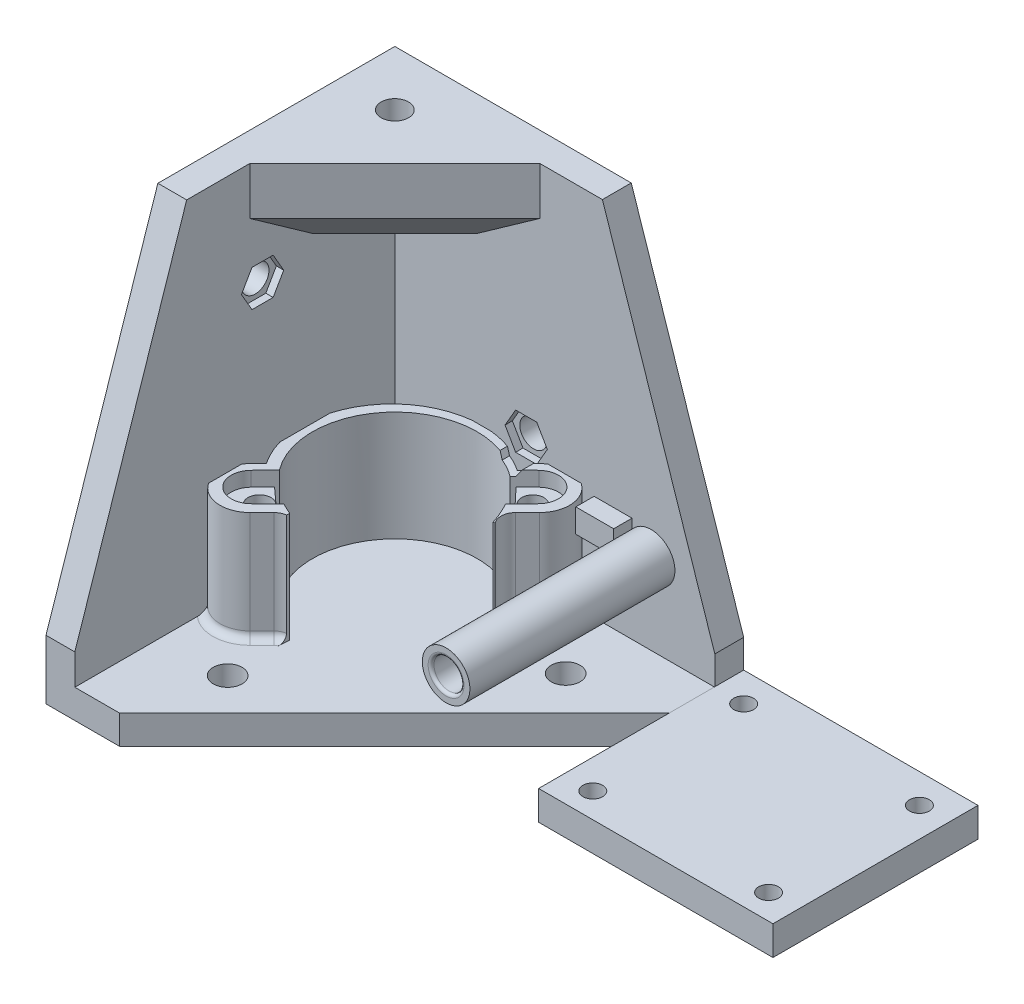
from build123d import *

# Parameters (mm, degrees)
BOSS_EXTRUDE1_DEPTH     = 5
BOSS_EXTRUDE2_DEPTH     = 5
BOSS_EXTRUDE3_DEPTH     = 5
SKETCH6_R               = 2.5
CUT_EXTRUDE1_DEPTH      = 107.549284371
SKETCH9_R               = 4.1275
SKETCH9_R_2             = 2.6035
BOSS_EXTRUDE5_DEPTH     = 35.56
FILLET1_R               = 0.508
BOSS_EXTRUDE6_DEPTH     = 19.05
SKETCH15_R              = 2.38125
BOSS_EXTRUDE7_DEPTH     = 15.875
CHAMFER2_SIZE           = 7.62
FILLET2_R               = 1.27
SKETCH16_W              = 7.844007501
SKETCH16_H              = 4.112882263
BOSS_EXTRUDE8_DEPTH     = 3.175
CHAMFER3_SIZE           = 1.27
SKETCH17_R              = 1.984375
SKETCH17_R_2            = 1.9288125
BOSS_EXTRUDE9_DEPTH     = 16.51
CUT_EXTRUDE2_REACH      = 111.603
SKETCH18_R              = 2.38125
CUT_EXTRUDE3_REACH      = 111.603
SKETCH19_R              = 2.38125
CUT_EXTRUDE4_DEPTH      = 4.13271
CUT_EXTRUDE4_DEPTH_BACK = 1.27
CUT_EXTRUDE5_DEPTH      = 1.27
SKETCH23_W              = 40.64
SKETCH23_H              = 35.56
BOSS_EXTRUDE12_DEPTH    = 5.08
CUT_EXTRUDE6_REACH      = 135.834
SKETCH24_R              = 1.7145


with BuildPart() as part:
    # Sketch1 → Boss-Extrude1 (new body)
    with BuildSketch(Plane(origin=(0, 0, 0), x_dir=(1, 0, 0), z_dir=(0, 1, 0))):
        Polygon((0, 0), (0, 60.5), (60.5, 60.5), (60.5, 47.75), (12.75, 0), align=None)
    extrude(amount=BOSS_EXTRUDE1_DEPTH)

    # Sketch4 → Boss-Extrude2 (add)
    with BuildSketch(Plane.ZY):
        Polygon((-60.5, 5), (-60.5, 68.5), (-19.4, 68.5), (0, 10.308629506), (0, 5), align=None)
    extrude(amount=-BOSS_EXTRUDE2_DEPTH)

    # Sketch5 → Boss-Extrude3 (add)
    with BuildSketch(Plane(origin=(0, 0, -60.5), x_dir=(-1, 0, 0), z_dir=(0, 0, -1))):
        Polygon((-5, 5), (-5, 68.5), (-41, 68.5), (-60.5, 10.004653177), (-60.5, 5), align=None)
    extrude(amount=-BOSS_EXTRUDE3_DEPTH)

    # Sketch6 → Cut-Extrude1 (cut, through all)
    with BuildSketch(Plane(origin=(0, 5, 0), x_dir=(1, 0, 0), z_dir=(0, 1, 0))):
        with Locations(Location((16.5, 15, 0), (0, 0, 270))):
            Circle(SKETCH6_R)
        with Locations(Location((45.5, 44.625, 0), (0, 0, 270))):
            Circle(SKETCH6_R)
    extrude(amount=-CUT_EXTRUDE1_DEPTH, mode=Mode.SUBTRACT)

    # Sketch9 → Boss-Extrude5 (add)
    with BuildSketch(Plane.XY.offset(-55.5)):
        with Locations(Location((49.45, 19.0462, 0), (0, 0, 180))):
            Circle(SKETCH9_R)
        with Locations(Location((49.45, 19.0462, 0), (0, 0, 180))):
            Circle(SKETCH9_R_2, mode=Mode.SUBTRACT)
    extrude(amount=BOSS_EXTRUDE5_DEPTH)

    # Fillet1
    fillet1_edges = [part.edges().sort_by_distance(p)[0] for p in [
        (52.0535, 19.0462, -19.94),
    ]]
    fillet(fillet1_edges, radius=FILLET1_R)

    # Sketch14 → Boss-Extrude6 (add)
    with BuildSketch(Plane(origin=(0, 5, 0), x_dir=(1, 0, 0), z_dir=(0, 1, 0))):
        with BuildLine():
            Line((6.722962691, 28.802730135), (9.132707699, 31.364136576))
            ThreePointArc((9.132707699, 31.364136576), (10.457950503, 50.042049497), (29.135863424, 51.367292301))
            Line((29.135863424, 51.367292301), (31.697269865, 53.777037309))
            ThreePointArc((31.697269865, 53.777037309), (36.686417723, 53.662894944), (36.648367319, 48.672586637))
            Line((36.648367319, 48.672586637), (33.860208422, 45.884427741))
            ThreePointArc((33.860208422, 45.884427741), (34.790141211, 43.96666613), (35.539002262, 41.971223395))
            Line((35.539002262, 41.971223395), (35.799607225, 42.077391474))
            Line((35.799607225, 42.077391474), (35.633459083, 42.367636838))
            ThreePointArc((35.633459083, 42.367636838), (35.320181387, 43.965693178), (36.041784088, 45.425561844))
            Line((36.041784088, 45.425561844), (38.110219678, 47.493997435))
            ThreePointArc((38.110219678, 47.493997435), (38.110219678, 54.843851927), (30.760365187, 54.843851927))
            Line((30.760365187, 54.843851927), (28.830026438, 52.913513178))
            ThreePointArc((28.830026438, 52.913513178), (8.980759009, 50.993661336), (7.060907167, 31.144393908))
            Line((7.060907167, 31.144393908), (5.656148073, 29.739634813))
            ThreePointArc((5.656148073, 29.739634813), (5.656148073, 22.389780322), (13.006002565, 22.389780322))
            Line((13.006002565, 22.389780322), (15.074438156, 24.458215912))
            ThreePointArc((15.074438156, 24.458215912), (15.744974902, 24.939184047), (16.534306822, 25.179818613))
            Line((16.534306822, 25.179818613), (16.568898656, 25.694636548))
            ThreePointArc((16.568898656, 25.694636548), (15.581109404, 26.144220149), (14.615572259, 26.639791578))
            Line((14.615572259, 26.639791578), (11.827413363, 23.851632681))
            ThreePointArc((11.827413363, 23.851632681), (6.837105056, 23.813582277), (6.722962691, 28.802730135))
        make_face()
    extrude(amount=BOSS_EXTRUDE6_DEPTH)

    # Sketch15 → Boss-Extrude7 (add)
    with BuildSketch(Plane(origin=(0, 68.5, 0), x_dir=(1, 0, 0), z_dir=(0, 1, 0))):
        Polygon((5, 55.5), (5, 30.3375), (30.1625, 55.5), align=None)
        with Locations(Location((9.525, 50.975, 0), (0, 0, 270))):
            Circle(SKETCH15_R, mode=Mode.SUBTRACT)
    extrude(amount=-BOSS_EXTRUDE7_DEPTH)

    # Chamfer2
    chamfer2_edges = [part.edges().sort_by_distance(p)[0] for p in [
        (17.58125, 52.625, -42.91875),
    ]]
    chamfer(chamfer2_edges, length=CHAMFER2_SIZE)

    # Fillet2
    fillet2_edges = [part.edges().sort_by_distance(p)[0] for p in [
        (15.744974902, 5, -24.939184047),
        (14.04022036, 5, -23.423998117),
        (8.812852099, 5, -20.893477035),
        (35.320181387, 5, -43.965693178),
        (35.716533154, 5, -42.222514156),
        (37.076001883, 5, -46.45977964),
        (39.606522965, 5, -51.687147901),
    ]]
    fillet(fillet2_edges, radius=FILLET2_R)

    # Sketch16 → Boss-Extrude8 (add)
    with BuildSketch(Plane.XY.offset(-55.5)):
        with Locations((42.208447341, 21.154254949)):
            Rectangle(SKETCH16_W, SKETCH16_H)
    extrude(amount=BOSS_EXTRUDE8_DEPTH)

    # Chamfer3
    chamfer3_edges = [part.edges().sort_by_distance(p)[0] for p in [
        (38.28644359, 23.21069608, -55.07937031),
    ]]
    chamfer(chamfer3_edges, length=CHAMFER3_SIZE)

    # Sketch17 → Boss-Extrude9 (add)
    # profile 1 of 2: a face of its own
    with BuildSketch(Plane(origin=(0, 5, 0), x_dir=(1, 0, 0), z_dir=(0, 1, 0))):
        with BuildLine():
            Line((14.046968971, 26.071188289), (8.715956726, 30.921156666))
            Line((8.715956726, 30.921156666), (6.722962691, 28.802730135))
            ThreePointArc((6.722962691, 28.802730135), (6.837105056, 23.813582277), (11.827413363, 23.851632681))
            Line((11.827413363, 23.851632681), (14.046968971, 26.071188289))
        make_face()
        with Locations(Location((10.020377911, 27.007841876, 0), (0, 0, 90))):
            Circle(SKETCH17_R, mode=Mode.SUBTRACT)
    # profile 2 of 2: a face of its own
    with BuildSketch(Plane(origin=(0, 5, 0), x_dir=(1, 0, 0), z_dir=(0, 1, 0))):
        with BuildLine():
            Line((31.697269865, 53.777037309), (29.66316707, 51.863374183))
            Line((29.66316707, 51.863374183), (34.595934869, 46.620154187))
            Line((34.595934869, 46.620154187), (36.648367319, 48.672586637))
            ThreePointArc((36.648367319, 48.672586637), (36.686417723, 53.662894944), (31.697269865, 53.777037309))
        make_face()
        with Locations(Location((33.690847255, 50.732351927, 0), (0, 0, 90))):
            Circle(SKETCH17_R_2, mode=Mode.SUBTRACT)
    extrude(amount=BOSS_EXTRUDE9_DEPTH)

    # Sketch18 → Cut-Extrude2 (cut, up to next)
    with BuildSketch(Plane.ZY, mode=Mode.PRIVATE) as cut_extrude2_sk1:
        with Locations((-32.56, 49.53)):
            Circle(SKETCH18_R)
    cut_extrude2_tool1 = extrude(cut_extrude2_sk1.sketch, amount=-CUT_EXTRUDE2_REACH, mode=Mode.PRIVATE) & part.part
    add(cut_extrude2_tool1.solids().sort_by_distance((0, 49.53, -32.56))[0], mode=Mode.SUBTRACT)

    # Sketch19 → Cut-Extrude3 (cut, up to next)
    with BuildSketch(Plane(origin=(0, 0, -60.5), x_dir=(-1, 0, 0), z_dir=(0, 0, -1)), mode=Mode.PRIVATE) as cut_extrude3_sk1:
        with Locations((-27.78125, 26.19375)):
            Circle(SKETCH19_R)
    cut_extrude3_tool1 = extrude(cut_extrude3_sk1.sketch, amount=-CUT_EXTRUDE3_REACH, mode=Mode.PRIVATE) & part.part
    add(cut_extrude3_tool1.solids().sort_by_distance((27.78125, 26.19375, -60.5))[0], mode=Mode.SUBTRACT)

    # Sketch20 → Cut-Extrude4 (cut, two sides: drawn at the far end of the back side and taken through both)
    with BuildSketch(Plane.XY.offset(-55.5).offset(-CUT_EXTRUDE4_DEPTH_BACK)):
        Polygon((31.447424209, 26.19375), (29.614337105, 29.36875), (25.948162895, 29.36875), (24.115075791, 26.19375), (25.948162895, 23.01875), (29.614337105, 23.01875), align=None)
    extrude(amount=CUT_EXTRUDE4_DEPTH + CUT_EXTRUDE4_DEPTH_BACK, mode=Mode.SUBTRACT)

    # Sketch21 → Cut-Extrude5 (cut)
    with BuildSketch(Plane(origin=(5, 0, 0), x_dir=(0, 0, -1), z_dir=(1, 0, 0))):
        Polygon((34.393087105, 52.705), (30.726912895, 52.705), (28.893825791, 49.53), (30.726912895, 46.355), (34.393087105, 46.355), (36.226174209, 49.53), align=None)
    extrude(amount=-CUT_EXTRUDE5_DEPTH, mode=Mode.SUBTRACT)

    # Sketch23 → Boss-Extrude12 (add)
    with BuildSketch(Plane(origin=(0, 0, 0), x_dir=(1, 0, 0), z_dir=(0, 1, 0))):
        with Locations((80.82, 42.72)):
            Rectangle(SKETCH23_W, SKETCH23_H)
    extrude(amount=BOSS_EXTRUDE12_DEPTH)

    # Sketch24 → Cut-Extrude6 (cut, up to next)
    with BuildSketch(Plane(origin=(0, 5.08, 0), x_dir=(1, 0, 0), z_dir=(0, 1, 0)), mode=Mode.PRIVATE) as cut_extrude6_sk1:
        with Locations(Location((65.58, 55.42, 0), (0, 0, 270))):
            Circle(SKETCH24_R)
    cut_extrude6_tool1 = extrude(cut_extrude6_sk1.sketch, amount=-CUT_EXTRUDE6_REACH, mode=Mode.PRIVATE) & part.part
    # Sketch24 → Cut-Extrude6 (cut, up to next)
    with BuildSketch(Plane(origin=(0, 5.08, 0), x_dir=(1, 0, 0), z_dir=(0, 1, 0)), mode=Mode.PRIVATE) as cut_extrude6_sk2:
        with Locations(Location((96.06, 55.42, 0), (0, 0, 270))):
            Circle(SKETCH24_R)
    cut_extrude6_tool2 = extrude(cut_extrude6_sk2.sketch, amount=-CUT_EXTRUDE6_REACH, mode=Mode.PRIVATE) & part.part
    # Sketch24 → Cut-Extrude6 (cut, up to next)
    with BuildSketch(Plane(origin=(0, 5.08, 0), x_dir=(1, 0, 0), z_dir=(0, 1, 0)), mode=Mode.PRIVATE) as cut_extrude6_sk3:
        with Locations(Location((96.06, 29.258, 0), (0, 0, 270))):
            Circle(SKETCH24_R)
    cut_extrude6_tool3 = extrude(cut_extrude6_sk3.sketch, amount=-CUT_EXTRUDE6_REACH, mode=Mode.PRIVATE) & part.part
    # Sketch24 → Cut-Extrude6 (cut, up to next)
    with BuildSketch(Plane(origin=(0, 5.08, 0), x_dir=(1, 0, 0), z_dir=(0, 1, 0)), mode=Mode.PRIVATE) as cut_extrude6_sk4:
        with Locations(Location((65.58, 29.258, 0), (0, 0, 270))):
            Circle(SKETCH24_R)
    cut_extrude6_tool4 = extrude(cut_extrude6_sk4.sketch, amount=-CUT_EXTRUDE6_REACH, mode=Mode.PRIVATE) & part.part
    add(cut_extrude6_tool1.solids().sort_by_distance((65.58, 5.08, -55.42))[0], mode=Mode.SUBTRACT)
    add(cut_extrude6_tool2.solids().sort_by_distance((96.06, 5.08, -55.42))[0], mode=Mode.SUBTRACT)
    add(cut_extrude6_tool3.solids().sort_by_distance((96.06, 5.08, -29.258))[0], mode=Mode.SUBTRACT)
    add(cut_extrude6_tool4.solids().sort_by_distance((65.58, 5.08, -29.258))[0], mode=Mode.SUBTRACT)


solid = part.part
